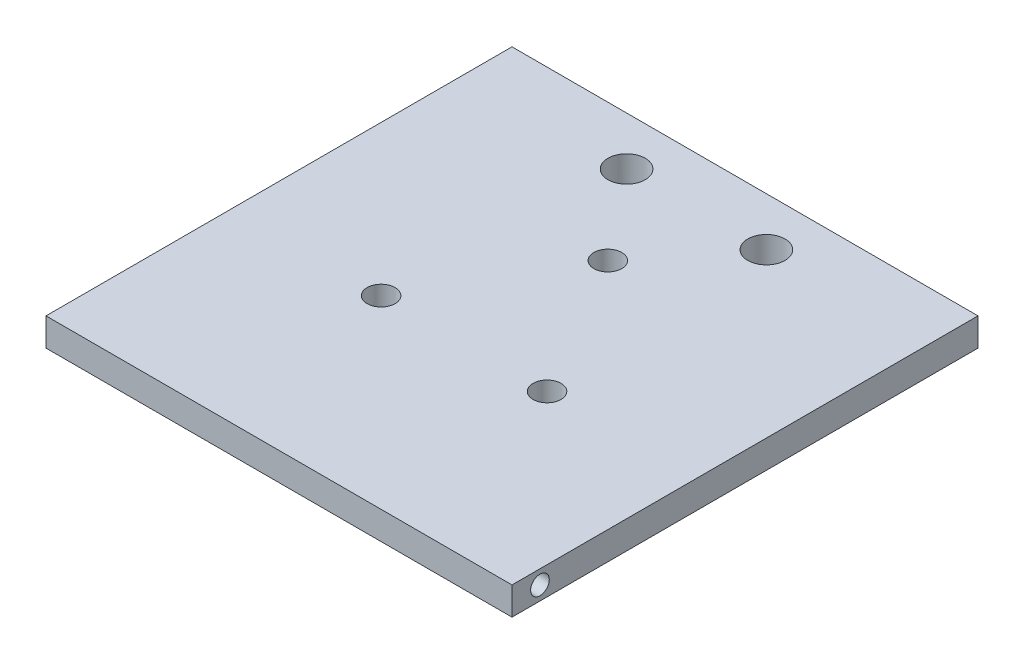
from build123d import *

# Parameters (mm, degrees)
SKETCH_1_W          = 50
SKETCH_1_H          = 50
SKETCH_1_R          = 1.5
EXTRUDE_1_DEPTH     = 3
SKETCH_2_R          = 1
CUT_EXTRUDE_2_DEPTH = 56.982140009
SKETCH_4_R          = 2
CUT_EXTRUDE_4_DEPTH = 50


with BuildPart() as part:
    # 草图1 → 凸台-拉伸1 (new body)
    with BuildSketch(Plane(origin=(0, 0, 0), x_dir=(1, 0, 0), z_dir=(0, 1, 0))):
        Rectangle(SKETCH_1_W, SKETCH_1_H)
        with Locations(Location((0, 10.279455753, 0), (0, 0, 270))):
            Circle(SKETCH_1_R, mode=Mode.SUBTRACT)
        with Locations(Location((8.902269819, -5.139727877, 0), (0, 0, 270))):
            Circle(SKETCH_1_R, mode=Mode.SUBTRACT)
        with Locations(Location((-8.902269819, -5.139727877, 0), (0, 0, 270))):
            Circle(SKETCH_1_R, mode=Mode.SUBTRACT)
    extrude(amount=EXTRUDE_1_DEPTH)

    # 草图2 → 切除-拉伸2 (cut, through all)
    with BuildSketch(Plane(origin=(25, 0, 0), x_dir=(0, 0, -1), z_dir=(1, 0, 0))):
        with Locations((-22, 1.5)):
            Circle(SKETCH_2_R)
    extrude(amount=-CUT_EXTRUDE_2_DEPTH, mode=Mode.SUBTRACT)

    # 草图4 → 切除-拉伸4 (cut)
    with BuildSketch(Plane.XZ):
        with Locations(Location((-7.5, -19.794917773, 0), (0, 0, 270))):
            Circle(SKETCH_4_R)
        with Locations(Location((7.5, -19.794917773, 0), (0, 0, 270))):
            Circle(SKETCH_4_R)
    extrude(amount=-CUT_EXTRUDE_4_DEPTH, mode=Mode.SUBTRACT)


solid = part.part
